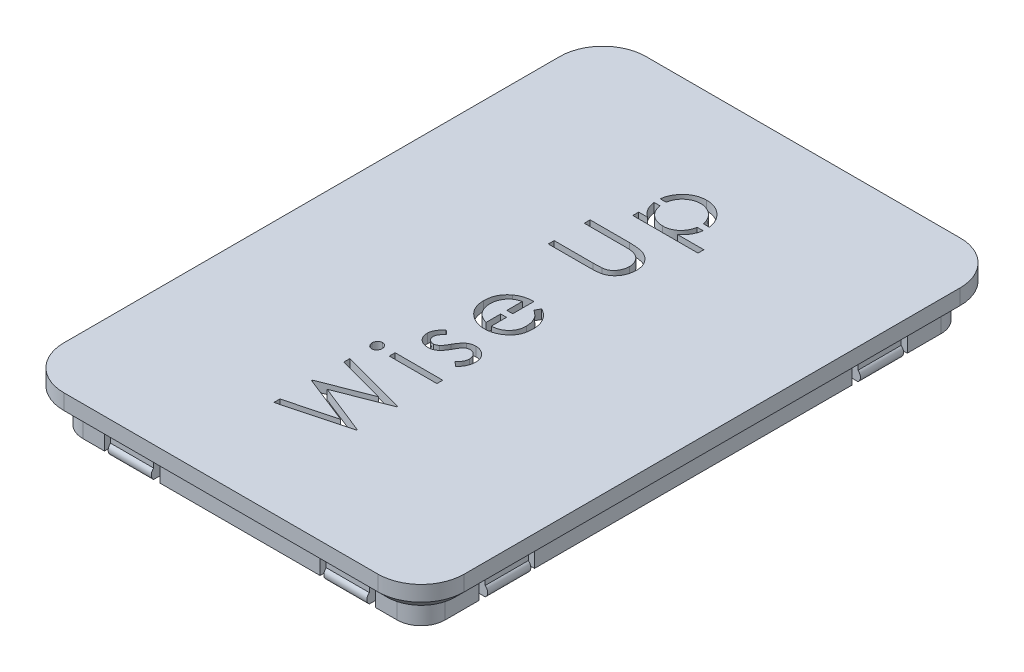
from build123d import *

# Parameters (mm, degrees)
BOSS_EXTRUDE1_DEPTH     = 4
CHAMFER1_SIZE           = 1.5
BOSS_EXTRUDE2_DEPTH     = 4
CUT_EXTRUDE1_START      = -2.5
CUT_EXTRUDE1_DEPTH      = 2.5
SKETCH4_W               = 1
SKETCH4_H               = 1
CUT_EXTRUDE2_DEPTH      = 4
SKETCH5_W               = 1
SKETCH5_H               = 1
CUT_EXTRUDE3_DEPTH      = 4
BOSS_EXTRUDE3_DEPTH     = 7
BOSS_EXTRUDE4_DEPTH     = 7
MIRROR2_COPY_1_SKETCH_W = 1
MIRROR2_COPY_1_SKETCH_H = 1
MIRROR2_COPY_1_DEPTH    = 4
MIRROR2_COPY_2_SKETCH_W = 1
MIRROR2_COPY_2_SKETCH_H = 1
MIRROR2_COPY_2_DEPTH    = 4
MIRROR2_COPY_3_DEPTH    = 7
MIRROR2_COPY_4_DEPTH    = 7
SKETCH9_W               = 7.733974359
SKETCH9_H               = 0.949786325
CUT_EXTRUDE4_DEPTH      = 1.5
SKETCH11_W              = 10
SKETCH11_H              = 1
SKETCH11_W_2            = 5
BOSS_EXTRUDE6_DEPTH     = 1.5


with BuildPart() as part:
    # Sketch1 → Boss-Extrude1 (new body)
    with BuildSketch(Plane(origin=(0, 0, 0), x_dir=(1, 0, 0), z_dir=(0, 1, 0))):
        with BuildLine():
            Line((-30.5, 40), (-30.5, -40.5))
            ThreePointArc((-30.5, -40.5), (-28.449747468, -45.449747468), (-23.5, -47.5))
            Line((-23.5, -47.5), (27.5, -47.5))
            ThreePointArc((27.5, -47.5), (32.449747468, -45.449747468), (34.5, -40.5))
            Line((34.5, -40.5), (34.5, 40))
            ThreePointArc((34.5, 40), (32.449747468, 44.949747468), (27.5, 47))
            Line((27.5, 47), (-23.5, 47))
            ThreePointArc((-23.5, 47), (-28.449747468, 44.949747468), (-30.5, 40))
        make_face()
    extrude(amount=BOSS_EXTRUDE1_DEPTH)

    # Chamfer1
    chamfer1_edges = [part.edges().sort_by_distance(p)[0] for p in [
        (2, 0, 47.5),
        (-28.449747468, 0, 45.449747468),
        (-30.5, 0, 0.25),
        (-28.449747468, 0, -44.949747468),
        (2, 0, -47),
        (32.449747468, 0, -44.949747468),
        (34.5, 0, 0.25),
        (32.449747468, 0, 45.449747468),
    ]]
    chamfer(chamfer1_edges, length=CHAMFER1_SIZE)

    # Sketch2 → Boss-Extrude2 (add)
    with BuildSketch(Plane.XZ):
        with BuildLine():
            Line((-27.4, 40.5), (-27.4, -40))
            ThreePointArc((-27.4, -40), (-26.257716447, -42.757716447), (-23.5, -43.9))
            Line((-23.5, -43.9), (27.5, -43.9))
            ThreePointArc((27.5, -43.9), (30.257716447, -42.757716447), (31.4, -40))
            Line((31.4, -40), (31.4, 40.5))
            ThreePointArc((31.4, 40.5), (30.257716447, 43.257716447), (27.5, 44.4))
            Line((27.5, 44.4), (-23.5, 44.4))
            ThreePointArc((-23.5, 44.4), (-26.257716447, 43.257716447), (-27.4, 40.5))
        make_face()
        with BuildLine():
            Line((27.5, 43.4), (-23.5, 43.4))
            ThreePointArc((-23.5, 43.4), (-25.550609665, 42.550609665), (-26.4, 40.5))
            Line((-26.4, 40.5), (-26.4, -40))
            ThreePointArc((-26.4, -40), (-25.550609665, -42.050609665), (-23.5, -42.9))
            Line((-23.5, -42.9), (27.5, -42.9))
            ThreePointArc((27.5, -42.9), (29.550609665, -42.050609665), (30.4, -40))
            Line((30.4, -40), (30.4, 40.5))
            ThreePointArc((30.4, 40.5), (29.550609665, 42.550609665), (27.5, 43.4))
        make_face(mode=Mode.SUBTRACT)
    extrude(amount=BOSS_EXTRUDE2_DEPTH)

    # Sketch3 → Cut-Extrude1 (cut)
    with BuildSketch(Plane.XZ.offset(CUT_EXTRUDE1_START)):
        with BuildLine():
            Line((30.4, -40), (30.4, 40.5))
            ThreePointArc((30.4, 40.5), (29.550609665, 42.550609665), (27.5, 43.4))
            Line((27.5, 43.4), (-23.5, 43.4))
            ThreePointArc((-23.5, 43.4), (-25.550609665, 42.550609665), (-26.4, 40.5))
            Line((-26.4, 40.5), (-26.4, -40))
            ThreePointArc((-26.4, -40), (-25.550609665, -42.050609665), (-23.5, -42.9))
            Line((-23.5, -42.9), (27.5, -42.9))
            ThreePointArc((27.5, -42.9), (29.550609665, -42.050609665), (30.4, -40))
        make_face()
    extrude(amount=CUT_EXTRUDE1_DEPTH, mode=Mode.SUBTRACT)

    # Sketch4 → Cut-Extrude2 (cut)
    with BuildSketch(Plane.XZ):
        with Locations((-19.5, 43.9)):
            Rectangle(SKETCH4_W, SKETCH4_H)
        with Locations((-11.5, 43.9)):
            Rectangle(SKETCH4_W, SKETCH4_H)
    cut_extrude2 = extrude(amount=CUT_EXTRUDE2_DEPTH, mode=Mode.SUBTRACT)

    # Sketch5 → Cut-Extrude3 (cut)
    with BuildSketch(Plane.XZ):
        with Locations((-26.9, 34.5)):
            Rectangle(SKETCH5_W, SKETCH5_H)
        with Locations((-26.9, 26.5)):
            Rectangle(SKETCH5_W, SKETCH5_H)
    cut_extrude3 = extrude(amount=CUT_EXTRUDE3_DEPTH, mode=Mode.SUBTRACT)

    # Sketch6 → Boss-Extrude3 (add)
    with BuildSketch(Plane(origin=(0, 0, 27), x_dir=(-1, 0, 0), z_dir=(0, 0, -1))):
        with BuildLine():
            Line((27.4, -4), (27.4, -2.4))
            ThreePointArc((27.4, -2.4), (27.8, -3.2), (27.4, -4))
        make_face()
    boss_extrude3 = extrude(amount=-BOSS_EXTRUDE3_DEPTH)

    # Sketch7 → Boss-Extrude4 (add)
    with BuildSketch(Plane.ZY.offset(19)):
        with BuildLine():
            Line((44.4, -2.4), (44.4, -4))
            ThreePointArc((44.4, -4), (44.8, -3.2), (44.4, -2.4))
        make_face()
    boss_extrude4 = extrude(amount=-BOSS_EXTRUDE4_DEPTH)

    # Mirror1: Cut-Extrude2, Cut-Extrude3, Boss-Extrude3, Boss-Extrude4 across plane
    add(cut_extrude2.mirror(Plane(origin=(2, 0, 0), x_dir=(0, 0, 1), z_dir=(1, 0, 0))), mode=Mode.SUBTRACT)
    add(cut_extrude3.mirror(Plane(origin=(2, 0, 0), x_dir=(0, 0, 1), z_dir=(1, 0, 0))), mode=Mode.SUBTRACT)
    add(boss_extrude3.mirror(Plane(origin=(2, 0, 0), x_dir=(0, 0, 1), z_dir=(1, 0, 0))))
    add(boss_extrude4.mirror(Plane(origin=(2, 0, 0), x_dir=(0, 0, 1), z_dir=(1, 0, 0))))

    # Mirror2: Cut-Extrude2, Cut-Extrude3, Boss-Extrude3, Boss-Extrude4 across plane
    add(cut_extrude2.mirror(Plane(origin=(0, 0, 0.25), x_dir=(1, 0, 0), z_dir=(0, 0, -1))), mode=Mode.SUBTRACT)
    add(cut_extrude3.mirror(Plane(origin=(0, 0, 0.25), x_dir=(1, 0, 0), z_dir=(0, 0, -1))), mode=Mode.SUBTRACT)
    add(boss_extrude3.mirror(Plane(origin=(0, 0, 0.25), x_dir=(1, 0, 0), z_dir=(0, 0, -1))))
    add(boss_extrude4.mirror(Plane(origin=(0, 0, 0.25), x_dir=(1, 0, 0), z_dir=(0, 0, -1))))

    # Mirror2 copy 1 sketch → Mirror2 copy 1 (cut)
    with BuildSketch(Plane(origin=(4, 0, 0.5), x_dir=(-1, 0, 0), z_dir=(0, -1, 0))):
        with Locations((-19.5, 43.9)):
            Rectangle(MIRROR2_COPY_1_SKETCH_W, MIRROR2_COPY_1_SKETCH_H)
        with Locations((-11.5, 43.9)):
            Rectangle(MIRROR2_COPY_1_SKETCH_W, MIRROR2_COPY_1_SKETCH_H)
    extrude(amount=MIRROR2_COPY_1_DEPTH, mode=Mode.SUBTRACT)

    # Mirror2 copy 2 sketch → Mirror2 copy 2 (cut)
    with BuildSketch(Plane(origin=(4, 0, 0.5), x_dir=(-1, 0, 0), z_dir=(0, -1, 0))):
        with Locations((-26.9, 34.5)):
            Rectangle(MIRROR2_COPY_2_SKETCH_W, MIRROR2_COPY_2_SKETCH_H)
        with Locations((-26.9, 26.5)):
            Rectangle(MIRROR2_COPY_2_SKETCH_W, MIRROR2_COPY_2_SKETCH_H)
    extrude(amount=MIRROR2_COPY_2_DEPTH, mode=Mode.SUBTRACT)

    # Mirror2 copy 3 sketch → Mirror2 copy 3 (add)
    with BuildSketch(Plane(origin=(4, 0, -26.5), x_dir=(1, 0, 0), z_dir=(0, 0, 1))):
        with BuildLine():
            Line((27.4, -4), (27.4, -2.4))
            ThreePointArc((27.4, -2.4), (27.8, -3.2), (27.4, -4))
        make_face()
    extrude(amount=-MIRROR2_COPY_3_DEPTH)

    # Mirror2 copy 4 sketch → Mirror2 copy 4 (add)
    with BuildSketch(Plane(origin=(23, 0, 0.5), x_dir=(0, 0, -1), z_dir=(1, 0, 0))):
        with BuildLine():
            Line((44.4, -2.4), (44.4, -4))
            ThreePointArc((44.4, -4), (44.8, -3.2), (44.4, -2.4))
        make_face()
    extrude(amount=-MIRROR2_COPY_4_DEPTH)

    # Sketch9 → Cut-Extrude4 (cut)
    # profile 1 of 7: a face of its own
    with BuildSketch(Plane(origin=(0, 4, 0), x_dir=(1, 0, 0), z_dir=(0, 1, 0))):
        Polygon((-5.083333333, -31.821581197), (-5.083333333, -30.83999399), (2.67820179, -28.768696581), (-5.083333333, -25.688251202), (-5.083333333, -25.550447382), (2.625200321, -22.52724359), (-5.083333333, -20.445345887), (-5.083333333, -19.474358974), (5.5, -22.327958066), (5.5, -22.463641827), (-2.594384348, -25.647970085), (5.5, -28.870459402), (5.5, -29.006143162), align=None)
    # profile 2 of 7: a face of its own
    with BuildSketch(Plane(origin=(0, 4, 0), x_dir=(1, 0, 0), z_dir=(0, 1, 0))):
        with BuildLine():
            add(Edge.make_bspline(
                [(-5.490384615, -15.467559206), (-5.487650631, -15.40862118), (-5.482296964, -15.293209204), (-5.436451545, -15.126315276), (-5.358740591, -14.974347644), (-5.254480604, -14.839553071), (-5.131866811, -14.723886652), (-4.988958645, -14.642906884), (-4.834567046, -14.590859877), (-4.7268738, -14.584574722), (-4.672041934, -14.581374644)],
                knots=[0, 0, 0, 0, 1.055194115, 2.066272739, 3.074728998, 4.095836921, 5.109056067, 6.073838105, 7.019297344, 8, 8, 8, 8], degree=3))
            add(Edge.make_bspline(
                [(-4.672041934, -14.581374644), (-4.618633435, -14.584646889), (-4.513051153, -14.591115731), (-4.361336131, -14.642866683), (-4.220413654, -14.724576783), (-4.098037935, -14.839478901), (-3.993835585, -14.974367298), (-3.91610935, -15.126310055), (-3.870267982, -15.293210578), (-3.864913757, -15.408621644), (-3.862179487, -15.467559206)],
                knots=[0, 0, 0, 0, 0.96129708, 1.900370562, 2.859976407, 3.87933698, 4.906634145, 5.921202961, 6.938410037, 8, 8, 8, 8], degree=3))
            add(Edge.make_bspline(
                [(-3.862179487, -15.467559206), (-3.864809355, -15.5258228), (-3.86992805, -15.639225273), (-3.917008818, -15.803620249), (-3.993862182, -15.95429211), (-4.097355647, -16.089349572), (-4.221165217, -16.201926585), (-4.361250129, -16.283866759), (-4.513073049, -16.335498191), (-4.61864079, -16.34198314), (-4.672041934, -16.345263533)],
                knots=[0, 0, 0, 0, 1.054934014, 2.053291228, 3.073705704, 4.106921865, 5.123545215, 6.088680038, 7.033164197, 8, 8, 8, 8], degree=3))
            add(Edge.make_bspline(
                [(-4.672041934, -16.345263533), (-4.726866169, -16.342055009), (-4.834544428, -16.335753266), (-4.989046075, -16.283828057), (-5.131109187, -16.202609115), (-5.255162483, -16.08927503), (-5.358714155, -15.954311948), (-5.435552123, -15.803615123), (-5.482636887, -15.639226627), (-5.487755031, -15.525823259), (-5.490384615, -15.467559206)],
                knots=[0, 0, 0, 0, 0.98631895, 1.937192651, 2.907499808, 3.917963147, 4.944918757, 5.95915025, 6.951458133, 8, 8, 8, 8], degree=3))
        make_face()
    # profile 3 of 7: a face of its own
    with BuildSketch(Plane(origin=(0, 4, 0), x_dir=(1, 0, 0), z_dir=(0, 1, 0))):
        with Locations((1.63301282, -15.463319089)):
            Rectangle(SKETCH9_W, SKETCH9_H)
    # profile 4 of 7: a face of its own
    with BuildSketch(Plane(origin=(0, 4, 0), x_dir=(1, 0, 0), z_dir=(0, 1, 0))):
        with BuildLine():
            Line((-1.269347623, -7.653133903), (-0.605769231, -8.297631766))
            add(Edge.make_bspline(
                [(-0.605769231, -8.297631766), (-0.670216126, -8.353241146), (-0.794462152, -8.460449484), (-0.960581377, -8.630482771), (-1.100090692, -8.799887477), (-1.217874904, -8.966344604), (-1.306923514, -9.134039846), (-1.371919882, -9.301005289), (-1.412142009, -9.467413808), (-1.417326145, -9.578647772), (-1.419871795, -9.633268786)],
                knots=[0, 0, 0, 0, 1.26578478, 2.440284043, 3.530471711, 4.527705817, 5.468200915, 6.346673037, 7.188140097, 8, 8, 8, 8], degree=3))
            add(Edge.make_bspline(
                [(-1.419871795, -9.633268786), (-1.416613136, -9.700206811), (-1.410200557, -9.83193137), (-1.34647994, -10.020800514), (-1.248234845, -10.195210383), (-1.111557745, -10.348235446), (-0.951502527, -10.476681647), (-0.771898701, -10.569366033), (-0.579625417, -10.627299754), (-0.446462023, -10.63451642), (-0.378922943, -10.638176638)],
                knots=[0, 0, 0, 0, 0.999370852, 1.966620401, 2.952450547, 3.979894107, 5.019529251, 6.00881856, 6.990093614, 8, 8, 8, 8], degree=3))
            add(Edge.make_bspline(
                [(-0.378922943, -10.638176638), (-0.317805572, -10.634817753), (-0.195743118, -10.628109453), (-0.015681206, -10.57595878), (0.159872219, -10.492906609), (0.267407674, -10.415284831), (0.322816506, -10.375289352)],
                knots=[0, 0, 0, 0, 0.960159726, 1.917612774, 2.927026955, 4, 4, 4, 4], degree=3))
            add(Edge.make_bspline(
                [(0.322816506, -10.375289352), (0.352272176, -10.351085396), (0.415344465, -10.2992584), (0.505104918, -10.205253566), (0.598961788, -10.093895291), (0.69627832, -9.964126329), (0.797156461, -9.815685847), (0.903309824, -9.65074923), (1.011631041, -9.467277985), (1.082848853, -9.338067144), (1.1199586, -9.270738738)],
                knots=[0, 0, 0, 0, 0.667332049, 1.428932371, 2.272176193, 3.217953793, 4.268659351, 5.415594948, 6.6533338, 8, 8, 8, 8], degree=3))
            add(Edge.make_bspline(
                [(1.1199586, -9.270738738), (1.166036898, -9.188435336), (1.255044996, -9.029452265), (1.393523305, -8.803793766), (1.530235658, -8.597786749), (1.668307822, -8.414275634), (1.802060267, -8.248957443), (1.935190503, -8.104488676), (2.068050408, -7.980421885), (2.161000307, -7.911028785), (2.205428686, -7.877860132)],
                knots=[0, 0, 0, 0, 1.271974443, 2.457035787, 3.569878245, 4.604907449, 5.553098313, 6.436573686, 7.252710343, 8, 8, 8, 8], degree=3))
            add(Edge.make_bspline(
                [(2.205428686, -7.877860132), (2.295103805, -7.822712843), (2.474135191, -7.712614349), (2.768595229, -7.598924781), (3.080042566, -7.531124187), (3.292671878, -7.522069346), (3.401141827, -7.517450142)],
                knots=[0, 0, 0, 0, 0.995432674, 1.98732596, 2.973261739, 4, 4, 4, 4], degree=3))
            add(Edge.make_bspline(
                [(3.401141827, -7.517450142), (3.477550781, -7.519626052), (3.628122971, -7.52391392), (3.849875413, -7.553720304), (4.061942023, -7.604998233), (4.266665041, -7.674795277), (4.459969333, -7.769218931), (4.646819949, -7.878965868), (4.821572298, -8.013049011), (4.987277812, -8.163692128), (5.138840058, -8.329538077), (5.271449846, -8.50715605), (5.384937067, -8.69405715), (5.475894658, -8.892950405), (5.548865869, -9.101368177), (5.599197039, -9.320357781), (5.629367238, -9.549036111), (5.633551631, -9.704551246), (5.635683761, -9.783792958)],
                knots=[0, 0, 0, 0, 1.03294705, 2.035535002, 3.018074688, 3.978914202, 4.953244146, 5.921606783, 6.903774788, 7.924990491, 8.946206195, 9.936011882, 10.917482605, 11.896392379, 12.887442265, 13.897874922, 14.928876017, 16, 16, 16, 16], degree=3))
            add(Edge.make_bspline(
                [(5.635683761, -9.783792958), (5.63269562, -9.890741867), (5.626760858, -10.103153639), (5.570601418, -10.417218041), (5.484224591, -10.724754296), (5.361074969, -11.02134364), (5.209673798, -11.302455191), (5.030541626, -11.561177965), (4.824625345, -11.794820126), (4.667124937, -11.928282872), (4.588374733, -11.995014245)],
                knots=[0, 0, 0, 0, 1.014105853, 2.01412079, 3.018242674, 4.040740662, 5.055023907, 6.042888753, 7.021444376, 8, 8, 8, 8], degree=3))
            Line((4.588374733, -11.995014245), (3.871794872, -11.365356793))
            add(Edge.make_bspline(
                [(3.871794872, -11.365356793), (3.936367612, -11.305568782), (4.061551633, -11.189660684), (4.228237139, -11.00429748), (4.367940983, -10.815674053), (4.484791309, -10.62567393), (4.574826456, -10.431484597), (4.6380803, -10.234194287), (4.678732976, -10.03420429), (4.683505401, -9.899880213), (4.685897436, -9.832554309)],
                knots=[0, 0, 0, 0, 1.179806542, 2.287233372, 3.337373186, 4.324005949, 5.273901747, 6.200048787, 7.097828587, 8, 8, 8, 8], degree=3))
            add(Edge.make_bspline(
                [(4.685897436, -9.832554309), (4.681751953, -9.740879354), (4.673652376, -9.561761869), (4.600127315, -9.305200969), (4.484810149, -9.068355599), (4.321342424, -8.862529926), (4.131159785, -8.68834831), (3.917713723, -8.559680995), (3.684819774, -8.481717868), (3.523273867, -8.472106358), (3.441422943, -8.467236467)],
                knots=[0, 0, 0, 0, 1.072236613, 2.094970478, 3.102399718, 4.141104368, 5.155589565, 6.110053346, 7.042415349, 8, 8, 8, 8], degree=3))
            add(Edge.make_bspline(
                [(3.441422943, -8.467236467), (3.373932851, -8.4704198), (3.241368334, -8.476672525), (3.049041625, -8.528839986), (2.865559718, -8.607742884), (2.758105269, -8.687552548), (2.703642495, -8.728003695)],
                knots=[0, 0, 0, 0, 1.014054094, 1.991812201, 2.982159616, 4, 4, 4, 4], degree=3))
            add(Edge.make_bspline(
                [(2.703642495, -8.728003695), (2.676313789, -8.752256638), (2.616781996, -8.805088307), (2.530976843, -8.902120165), (2.437900015, -9.017377122), (2.343182201, -9.155978392), (2.238253554, -9.31093111), (2.134198165, -9.490511345), (2.020711441, -9.687758923), (1.945707442, -9.827400811), (1.906500401, -9.900396189)],
                knots=[0, 0, 0, 0, 0.615029206, 1.339755737, 2.178261527, 3.109653826, 4.166232585, 5.329982127, 6.604294388, 8, 8, 8, 8], degree=3))
            add(Edge.make_bspline(
                [(1.906500401, -9.900396189), (1.862536836, -9.979156268), (1.777277453, -10.131897195), (1.644483592, -10.348242574), (1.509418261, -10.543421479), (1.379658009, -10.722130359), (1.248361345, -10.879855305), (1.115382513, -11.015974958), (0.98608446, -11.135848492), (0.894471206, -11.202213284), (0.850711138, -11.23391315)],
                knots=[0, 0, 0, 0, 1.262093308, 2.447601706, 3.550203992, 4.582594899, 5.537233252, 6.418365656, 7.244515135, 8, 8, 8, 8], degree=3))
            add(Edge.make_bspline(
                [(0.850711138, -11.23391315), (0.76255282, -11.288657176), (0.586767771, -11.397815127), (0.292997124, -11.505686024), (-0.017112446, -11.577787837), (-0.231501631, -11.58452796), (-0.340761886, -11.587962963)],
                knots=[0, 0, 0, 0, 0.984940175, 1.963941237, 2.962352981, 4, 4, 4, 4], degree=3))
            add(Edge.make_bspline(
                [(-0.340761886, -11.587962963), (-0.412201531, -11.586349801), (-0.552019039, -11.583192614), (-0.757439821, -11.557931619), (-0.952669572, -11.512104888), (-1.140972095, -11.453896473), (-1.319066287, -11.374907636), (-1.487775599, -11.278556883), (-1.647283761, -11.166203025), (-1.795432268, -11.036620101), (-1.930084898, -10.894215136), (-2.04717999, -10.740209467), (-2.147942504, -10.578974817), (-2.22877169, -10.407243385), (-2.292975466, -10.227033653), (-2.336471977, -10.036988983), (-2.365727667, -9.838410683), (-2.368329101, -9.702634199), (-2.36965812, -9.633268786)],
                knots=[0, 0, 0, 0, 1.087304385, 2.128008728, 3.143103065, 4.136477636, 5.123835063, 6.101831209, 7.089715868, 8.088492253, 9.092987035, 10.067605355, 11.028834439, 11.98153898, 12.951158004, 13.934816901, 14.944940436, 16, 16, 16, 16], degree=3))
            add(Edge.make_bspline(
                [(-2.36965812, -9.633268786), (-2.366318804, -9.551045165), (-2.35957753, -9.385055494), (-2.306038894, -9.136030792), (-2.217945936, -8.887372829), (-2.096279231, -8.638442699), (-1.938838916, -8.391063967), (-1.748552701, -8.143060615), (-1.526672469, -7.89145538), (-1.357039097, -7.734349386), (-1.269347623, -7.653133903)],
                knots=[0, 0, 0, 0, 0.845714091, 1.707292901, 2.609013841, 3.555613372, 4.552488639, 5.621697636, 6.770543573, 8, 8, 8, 8], degree=3))
        make_face()
    # profile 5 of 7: a face of its own
    with BuildSketch(Plane(origin=(0, 4, 0), x_dir=(1, 0, 0), z_dir=(0, 1, 0))):
        with BuildLine():
            Line((3.057692308, 2.23046875), (3.500784589, 3.074252137))
            add(Edge.make_bspline(
                [(3.500784589, 3.074252137), (3.620025437, 3.006977633), (3.852020906, 2.87608809), (4.170772669, 2.651912158), (4.455819739, 2.414759412), (4.702597691, 2.157414238), (4.920533266, 1.887631535), (5.108514887, 1.60028729), (5.26993442, 1.297726918), (5.402202665, 0.976617868), (5.50618627, 0.637344796), (5.582978872, 0.277939001), (5.627511284, -0.103296499), (5.63291618, -0.364366053), (5.635683761, -0.498046875)],
                knots=[0, 0, 0, 0, 1.120611642, 2.180266485, 3.186550691, 4.152466804, 5.095166165, 6.022949561, 6.960161436, 7.899497276, 8.862391909, 9.862399089, 10.905440174, 12, 12, 12, 12], degree=3))
            add(Edge.make_bspline(
                [(5.635683761, -0.498046875), (5.632214921, -0.646642854), (5.625448219, -0.936510562), (5.567111483, -1.358452182), (5.47194506, -1.755718506), (5.339001655, -2.128287272), (5.165352301, -2.475245829), (4.953808393, -2.79728472), (4.705455192, -3.096093901), (4.41814701, -3.362270857), (4.110667359, -3.601857675), (3.790323137, -3.813414215), (3.458223729, -3.989459585), (3.116345055, -4.134850333), (2.765463999, -4.249536082), (2.403571025, -4.331033543), (2.032101142, -4.377579492), (1.78083585, -4.384744149), (1.654213408, -4.388354701)],
                knots=[0, 0, 0, 0, 1.14524686, 2.234044844, 3.276713788, 4.290115724, 5.276966211, 6.260758605, 7.254862358, 8.264742877, 9.274005885, 10.257798278, 11.220590477, 12.167824544, 13.118936889, 14.062732937, 15.023735098, 16, 16, 16, 16], degree=3))
            add(Edge.make_bspline(
                [(1.654213408, -4.388354701), (1.535393326, -4.385152059), (1.299907613, -4.378804846), (0.951366562, -4.338797465), (0.61261386, -4.267894294), (0.28336803, -4.170599219), (-0.035819661, -4.044956165), (-0.345143473, -3.891249216), (-0.644274253, -3.709238931), (-0.832969443, -3.568714418), (-0.928018162, -3.497930021)],
                knots=[0, 0, 0, 0, 1.024358464, 2.0301432, 3.019427413, 4.004406732, 4.986367066, 5.972626655, 6.978780325, 8, 8, 8, 8], degree=3))
            add(Edge.make_bspline(
                [(-0.928018162, -3.497930021), (-1.042716274, -3.40221732), (-1.268110724, -3.214131298), (-1.561570905, -2.892710141), (-1.812601004, -2.549357235), (-2.017391854, -2.18061886), (-2.174908397, -1.787116137), (-2.286947831, -1.370878722), (-2.356663884, -0.930756145), (-2.365260855, -0.629047304), (-2.36965812, -0.474726229)],
                knots=[0, 0, 0, 0, 1.030811313, 2.025658015, 2.997072178, 3.962767568, 4.930766827, 5.917075773, 6.934604948, 8, 8, 8, 8], degree=3))
            add(Edge.make_bspline(
                [(-2.36965812, -0.474726229), (-2.36558424, -0.316125541), (-2.357592217, -0.004987146), (-2.282837139, 0.448552566), (-2.165728819, 0.878544044), (-1.995107556, 1.281438789), (-1.783610847, 1.663444815), (-1.516288909, 2.015770295), (-1.206871713, 2.348086795), (-0.968668679, 2.541313923), (-0.847455929, 2.639640091)],
                knots=[0, 0, 0, 0, 1.056389096, 2.072394598, 3.055233004, 4.020130009, 4.981825462, 5.957811105, 6.960805292, 8, 8, 8, 8], degree=3))
            add(Edge.make_bspline(
                [(-0.847455929, 2.639640091), (-0.756126052, 2.706547738), (-0.574074217, 2.839917674), (-0.277223338, 3.006974381), (0.033353936, 3.151988409), (0.362677929, 3.267899981), (0.70684666, 3.361757521), (1.068320545, 3.429662663), (1.446991944, 3.469485081), (1.705003195, 3.477312809), (1.836538462, 3.481303419)],
                knots=[0, 0, 0, 0, 0.94817472, 1.890038105, 2.849395472, 3.817997239, 4.812318967, 5.836947057, 6.897266129, 8, 8, 8, 8], degree=3))
            Line((1.836538462, 3.481303419), (1.836538462, -3.438568376))
            add(Edge.make_bspline(
                [(1.836538462, -3.438568376), (1.938442246, -3.433912899), (2.138831929, -3.424758093), (2.432053106, -3.382076588), (2.711372498, -3.314800534), (2.97469503, -3.220248845), (3.225459939, -3.105746717), (3.461807051, -2.965485145), (3.68265984, -2.798148875), (3.889993803, -2.611502117), (4.074629914, -2.403744948), (4.239886476, -2.185175689), (4.378393876, -1.952664195), (4.49081878, -1.708043799), (4.578830736, -1.451710068), (4.638907241, -1.18358224), (4.679145398, -0.904187936), (4.683619624, -0.713731073), (4.685897436, -0.616770166)],
                knots=[0, 0, 0, 0, 1.094153842, 2.151609401, 3.174256925, 4.172055639, 5.149267565, 6.128595816, 7.11444997, 8.118368179, 9.117203808, 10.09244225, 11.054858984, 12.015122123, 12.976791628, 13.957293641, 14.960065497, 16, 16, 16, 16], degree=3))
            add(Edge.make_bspline(
                [(4.685897436, -0.616770166), (4.684073594, -0.521966131), (4.680454743, -0.333856739), (4.644761576, -0.053789363), (4.588191003, 0.222226451), (4.506712173, 0.491449941), (4.411301562, 0.749957511), (4.299003889, 0.990672157), (4.170971831, 1.210411509), (4.025479433, 1.416587951), (3.84692205, 1.615486301), (3.626240731, 1.815918032), (3.360932504, 2.026090104), (3.162576112, 2.15977888), (3.057692308, 2.23046875)],
                knots=[0, 0, 0, 0, 0.991168677, 1.966668791, 2.94808785, 3.9350306, 4.905702032, 5.828266021, 6.709360349, 7.562606342, 8.463112863, 9.498839253, 10.677475166, 12, 12, 12, 12], degree=3))
        make_face()
        with BuildLine():
            add(Edge.make_bspline(
                [(0.886752137, 2.531517094), (0.760708587, 2.496894269), (0.518745919, 2.430429693), (0.183803194, 2.288881829), (-0.115589557, 2.133312728), (-0.374457094, 1.946038141), (-0.604734185, 1.73592324), (-0.80275311, 1.489873611), (-0.985263358, 1.218560707), (-1.137250945, 0.916580525), (-1.262148158, 0.595841658), (-1.353986218, 0.262936556), (-1.407971381, -0.079346397), (-1.415886343, -0.30988226), (-1.419871795, -0.425964877)],
                knots=[0, 0, 0, 0, 1.155085888, 2.217389643, 3.210301801, 4.133263417, 5.03575695, 5.95948047, 6.920061569, 7.923798377, 8.943125483, 9.960783337, 10.973185325, 12, 12, 12, 12], degree=3))
            add(Edge.make_bspline(
                [(-1.419871795, -0.425964877), (-1.418043785, -0.520766852), (-1.414430193, -0.708170424), (-1.379435085, -0.984142803), (-1.323201832, -1.24986107), (-1.240519492, -1.504532072), (-1.139911425, -1.749845131), (-1.016243754, -1.985622992), (-0.866727375, -2.208834687), (-0.752512595, -2.348341681), (-0.694811699, -2.418820112)],
                knots=[0, 0, 0, 0, 1.048823158, 2.073302879, 3.073550078, 4.050623576, 5.03253758, 6.005186856, 6.992227572, 8, 8, 8, 8], degree=3))
            add(Edge.make_bspline(
                [(-0.694811699, -2.418820112), (-0.649174161, -2.469305328), (-0.556814906, -2.571475101), (-0.397599335, -2.707847966), (-0.225815055, -2.839393931), (-0.033963526, -2.956291688), (0.172391768, -3.067385653), (0.39475655, -3.168621059), (0.634069426, -3.260668978), (0.800913294, -3.312341053), (0.886752137, -3.338925614)],
                knots=[0, 0, 0, 0, 0.879905587, 1.780714457, 2.708106151, 3.677566983, 4.684151534, 5.740052498, 6.837288539, 8, 8, 8, 8], degree=3))
            Line((0.886752137, -3.338925614), (0.886752137, 2.531517094))
        make_face(mode=Mode.SUBTRACT)
    # profile 6 of 7: a face of its own
    with BuildSketch(Plane(origin=(0, 4, 0), x_dir=(1, 0, 0), z_dir=(0, 1, 0))):
        with BuildLine():
            Line((-5.083333333, 12.724537037), (-5.083333333, 13.674323362))
            Line((-5.083333333, 13.674323362), (1.25776242, 13.674323362))
            add(Edge.make_bspline(
                [(1.25776242, 13.674323362), (1.347511311, 13.674182017), (1.517825299, 13.673913791), (1.76023897, 13.67570544), (1.97575331, 13.680723054), (2.165199052, 13.683886441), (2.327706883, 13.690923854), (2.464157228, 13.696663187), (2.573903983, 13.704042965), (2.637951069, 13.712912154), (2.665481437, 13.716724537)],
                knots=[0, 0, 0, 0, 1.528628734, 2.90083645, 4.128790002, 5.200304208, 6.127813768, 6.898992206, 7.526736466, 8, 8, 8, 8], degree=3))
            add(Edge.make_bspline(
                [(2.665481437, 13.716724537), (2.765565318, 13.732201855), (2.958772754, 13.762080122), (3.233705588, 13.841461101), (3.481944981, 13.947288733), (3.709090335, 14.07857424), (3.913698117, 14.244454047), (4.097338718, 14.450398949), (4.264221347, 14.692716632), (4.409719006, 14.967935394), (4.530567072, 15.261181468), (4.620992442, 15.561941983), (4.676332711, 15.864412271), (4.682723764, 16.06694076), (4.685897436, 16.167512464)],
                knots=[0, 0, 0, 0, 1.042777144, 2.01303441, 2.939567723, 3.817555404, 4.708046775, 5.641195415, 6.651191522, 7.732783915, 8.843021186, 9.914367358, 10.964315445, 12, 12, 12, 12], degree=3))
            add(Edge.make_bspline(
                [(4.685897436, 16.167512464), (4.682668317, 16.253861127), (4.67622873, 16.426059726), (4.635860611, 16.681780404), (4.564541755, 16.931624743), (4.467392454, 17.173629996), (4.347924857, 17.403863169), (4.204804618, 17.616421374), (4.038097257, 17.806908038), (3.85333949, 17.980737735), (3.645138849, 18.131218151), (3.418518203, 18.264266368), (3.167434811, 18.369931112), (2.991085699, 18.423428852), (2.900807959, 18.45081575)],
                knots=[0, 0, 0, 0, 0.994718802, 1.98369237, 2.973235266, 3.981451368, 4.982709966, 5.955777334, 6.925228988, 7.892833478, 8.871333226, 9.877970804, 10.913677552, 12, 12, 12, 12], degree=3))
            add(Edge.make_bspline(
                [(2.900807959, 18.45081575), (2.863468223, 18.459887557), (2.780260241, 18.4801032), (2.63958872, 18.498993074), (2.473613739, 18.518667568), (2.281142781, 18.532318767), (2.062820792, 18.54562722), (1.817510442, 18.55358913), (1.546102489, 18.557269206), (1.356699643, 18.558365882), (1.25776242, 18.558938746)],
                knots=[0, 0, 0, 0, 0.558680831, 1.244966039, 2.062412453, 2.990489873, 4.051219941, 5.244515665, 6.560634259, 8, 8, 8, 8], degree=3))
            Line((1.25776242, 18.558938746), (-5.083333333, 18.558938746))
            Line((-5.083333333, 18.558938746), (-5.083333333, 19.508725071))
            Line((-5.083333333, 19.508725071), (1.30864383, 19.508725071))
            add(Edge.make_bspline(
                [(1.30864383, 19.508725071), (1.423846048, 19.50795655), (1.648670182, 19.506456735), (1.978118656, 19.49345413), (2.290637265, 19.4727145), (2.586274422, 19.443438002), (2.863950233, 19.4045581), (3.125493685, 19.361721314), (3.369462795, 19.306215413), (3.598672337, 19.241862332), (3.817960945, 19.1693452), (4.025669065, 19.073772228), (4.227897104, 18.966560948), (4.422380646, 18.840432525), (4.607884054, 18.695327264), (4.7892093, 18.536804317), (4.960952404, 18.359276207), (5.125231541, 18.167986558), (5.278011181, 17.964221511), (5.410964102, 17.746665358), (5.51922383, 17.516519205), (5.615306473, 17.279232744), (5.683599568, 17.029116894), (5.735525928, 16.769287202), (5.764782689, 16.498202488), (5.769153969, 16.3138615), (5.771367521, 16.220513933)],
                knots=[0, 0, 0, 0, 1.316707045, 2.569633854, 3.76780728, 4.896239288, 5.964314126, 6.972204208, 7.924543903, 8.822147865, 9.693191779, 10.560896119, 11.431827672, 12.307838457, 13.206132673, 14.12176355, 15.058527151, 16.026630406, 17.00238624, 17.966538933, 18.934743273, 19.906713913, 20.888635248, 21.892958714, 22.933025263, 24, 24, 24, 24], degree=3))
            add(Edge.make_bspline(
                [(5.771367521, 16.220513933), (5.768996185, 16.118704237), (5.764343632, 15.918953976), (5.737642025, 15.624632733), (5.687476042, 15.342429997), (5.623185887, 15.069591544), (5.535965602, 14.808753297), (5.428795135, 14.559992123), (5.306443764, 14.320451725), (5.161866329, 14.095528891), (5.004214367, 13.883378508), (4.831050974, 13.690582318), (4.648971097, 13.512246171), (4.451118515, 13.356230728), (4.241543449, 13.216634966), (4.019260172, 13.096534948), (3.784566665, 12.993373231), (3.621421174, 12.940135652), (3.538945646, 12.913222267)],
                knots=[0, 0, 0, 0, 1.138939089, 2.234594419, 3.301501784, 4.342532435, 5.367382236, 6.373123747, 7.370098489, 8.372230273, 9.360297234, 10.323289009, 11.268038109, 12.20748145, 13.137029304, 14.081414587, 15.030090602, 16, 16, 16, 16], degree=3))
            add(Edge.make_bspline(
                [(3.538945646, 12.913222267), (3.48260429, 12.897567527), (3.360398634, 12.863612046), (3.158146633, 12.827249837), (2.925268192, 12.7966819), (2.661747369, 12.767938902), (2.367379916, 12.750978482), (2.042293432, 12.736109084), (1.686094834, 12.724432284), (1.437977608, 12.724501143), (1.30864383, 12.724537037)],
                knots=[0, 0, 0, 0, 0.625038921, 1.35572334, 2.194682327, 3.136881307, 4.189498639, 5.346923369, 6.617055217, 8, 8, 8, 8], degree=3))
            Line((1.30864383, 12.724537037), (-5.083333333, 12.724537037))
        make_face()
    # profile 7 of 7: a face of its own
    with BuildSketch(Plane(origin=(0, 4, 0), x_dir=(1, 0, 0), z_dir=(0, 1, 0))):
        with BuildLine():
            Line((-2.233974359, 23.587606838), (-2.233974359, 24.537393162))
            Line((-2.233974359, 24.537393162), (-0.802934696, 24.537393162))
            add(Edge.make_bspline(
                [(-0.802934696, 24.537393162), (-0.931770876, 24.638550575), (-1.182933, 24.835753802), (-1.512126484, 25.170499715), (-1.784138562, 25.530153381), (-2.003451397, 25.912446733), (-2.165411944, 26.319806939), (-2.285945861, 26.746410672), (-2.356760393, 27.197117541), (-2.365301995, 27.505227174), (-2.36965812, 27.662359776)],
                knots=[0, 0, 0, 0, 1.07939028, 2.104237756, 3.085658289, 4.045737152, 5.001099604, 5.968961907, 6.964192404, 8, 8, 8, 8], degree=3))
            add(Edge.make_bspline(
                [(-2.36965812, 27.662359776), (-2.365687317, 27.799615338), (-2.357838816, 28.070908167), (-2.304701247, 28.470242216), (-2.213631081, 28.854796352), (-2.08239498, 29.222394991), (-1.920151059, 29.576976165), (-1.715387642, 29.913290609), (-1.478302256, 30.236576837), (-1.205457419, 30.538704361), (-0.910248137, 30.817866592), (-0.592680693, 31.059306235), (-0.263198587, 31.267561755), (0.083306073, 31.435898127), (0.444104696, 31.567761464), (0.820654982, 31.661543941), (1.211560802, 31.717356339), (1.477361886, 31.724844657), (1.611812233, 31.728632479)],
                knots=[0, 0, 0, 0, 1.041296284, 2.058176809, 3.050446431, 4.034000596, 5.01514041, 6.003636468, 7.015969324, 8.052561599, 9.08815499, 10.094063707, 11.074456064, 12.040834395, 13.011057502, 13.983766392, 14.980127149, 16, 16, 16, 16], degree=3))
            add(Edge.make_bspline(
                [(1.611812233, 31.728632479), (1.749100166, 31.724926844), (2.019851782, 31.717618797), (2.417443719, 31.660937469), (2.799917444, 31.570353588), (3.166636789, 31.440153844), (3.517349258, 31.271904582), (3.851801932, 31.067178887), (4.169887654, 30.825617427), (4.46728809, 30.549540208), (4.741243155, 30.250022996), (4.980843984, 29.929869635), (5.182052429, 29.594048598), (5.350124711, 29.244277998), (5.476798696, 28.877563567), (5.56817157, 28.495616275), (5.624518735, 28.09864407), (5.631933547, 27.828614396), (5.635683761, 27.692040598)],
                knots=[0, 0, 0, 0, 1.038740735, 2.04854663, 3.033179607, 4.009277356, 4.987731542, 5.972001279, 6.972200261, 8.005528982, 9.039189865, 10.040446548, 11.026516639, 11.997840187, 12.972163198, 13.956796175, 14.96660207, 16, 16, 16, 16], degree=3))
            add(Edge.make_bspline(
                [(5.635683761, 27.692040598), (5.631463312, 27.538405719), (5.623129852, 27.235046952), (5.549165007, 26.790243363), (5.427686835, 26.364092168), (5.257325113, 25.957845463), (5.03852452, 25.57037174), (4.772182768, 25.203198888), (4.45834605, 24.854509184), (4.220279356, 24.644629461), (4.098641159, 24.537393162)],
                knots=[0, 0, 0, 0, 1.014661154, 2.003492687, 2.970165371, 3.937187664, 4.907406957, 5.904113462, 6.929124205, 8, 8, 8, 8], degree=3))
            Line((4.098641159, 24.537393162), (8.349358974, 24.537393162))
            Line((8.349358974, 24.537393162), (8.349358974, 23.587606838))
            Line((8.349358974, 23.587606838), (-2.233974359, 23.587606838))
        make_face()
        with BuildLine():
            add(Edge.make_bspline(
                [(-1.419871795, 27.653879541), (-1.417935776, 27.546293721), (-1.414124254, 27.334484972), (-1.368845885, 27.024023738), (-1.303115096, 26.724982802), (-1.203595779, 26.440375949), (-1.081437463, 26.167475275), (-0.928789476, 25.908382682), (-0.748413173, 25.663280037), (-0.543763728, 25.432784017), (-0.318264076, 25.224554534), (-0.077605701, 25.040214252), (0.177906626, 24.885373115), (0.445892841, 24.756855101), (0.728453584, 24.659055175), (1.023979599, 24.589641451), (1.332794348, 24.546006813), (1.543118463, 24.540295026), (1.649973291, 24.537393162)],
                knots=[0, 0, 0, 0, 1.05670511, 2.080379991, 3.077984906, 4.06214886, 5.038337365, 6.01289324, 7.01187578, 8.025460281, 9.038092164, 10.024533457, 11.000252242, 11.969694649, 12.940728589, 13.933144304, 14.949937299, 16, 16, 16, 16], degree=3))
            add(Edge.make_bspline(
                [(1.649973291, 24.537393162), (1.790236752, 24.542223831), (2.065024752, 24.55168752), (2.465953045, 24.627890705), (2.845014178, 24.753301036), (3.199741325, 24.930610372), (3.527935057, 25.152094285), (3.818389469, 25.423793521), (4.074909354, 25.735605952), (4.290972154, 26.086658115), (4.465528028, 26.463337412), (4.59444242, 26.854929749), (4.670958856, 27.258687117), (4.680890945, 27.53130223), (4.685897436, 27.668719952)],
                knots=[0, 0, 0, 0, 1.037533453, 2.032615907, 3.008487753, 3.983910949, 4.958815134, 5.928528047, 6.917017829, 7.938835504, 8.970843303, 9.983125212, 10.983349323, 12, 12, 12, 12], degree=3))
            add(Edge.make_bspline(
                [(4.685897436, 27.668719952), (4.681191112, 27.803387474), (4.671849904, 28.070678294), (4.591000736, 28.464253985), (4.46748544, 28.846728691), (4.287418055, 29.210164457), (4.066600032, 29.551194549), (3.80189507, 29.860137962), (3.492991287, 30.127779629), (3.151319316, 30.358078619), (2.785275279, 30.542193325), (2.407226764, 30.682049206), (2.017241993, 30.761726232), (1.754194529, 30.773132048), (1.622412527, 30.778846154)],
                knots=[0, 0, 0, 0, 1.001123591, 1.987050352, 2.978152323, 3.984730168, 4.995502505, 5.994801396, 7.000994558, 8.027767845, 9.053126238, 10.042874082, 11.019515457, 12, 12, 12, 12], degree=3))
            add(Edge.make_bspline(
                [(1.622412527, 30.778846154), (1.489805652, 30.774444329), (1.225625045, 30.765674975), (0.836236839, 30.679398729), (0.455706274, 30.549504633), (0.094318322, 30.361273509), (-0.244815188, 30.134539648), (-0.548150521, 29.866383155), (-0.808718501, 29.558946242), (-1.029711583, 29.220562996), (-1.202231806, 28.853903123), (-1.329109687, 28.469089437), (-1.405169174, 28.066747716), (-1.414927811, 27.792712848), (-1.419871795, 27.653879541)],
                knots=[0, 0, 0, 0, 0.984010603, 1.960354772, 2.950163297, 3.964735994, 4.97843856, 5.975353722, 6.962442164, 7.964544167, 8.969901786, 9.964615439, 10.968820376, 12, 12, 12, 12], degree=3))
        make_face(mode=Mode.SUBTRACT)
    extrude(amount=-CUT_EXTRUDE4_DEPTH, mode=Mode.SUBTRACT)


with BuildPart() as cut_extrude4_piece_1:
    # of the separate pieces the step leaves, piece 1, a body of its own (cut_extrude4_pieces)
    add(part.part.solids().sort_by_distance((-30.5, 1.5, -40))[0])



with BuildPart() as cut_extrude4_piece_2:
    # of the separate pieces the step leaves, piece 2, a body of its own (cut_extrude4_pieces)
    add(part.part.solids().sort_by_distance((1.622412527, 4, -30.778846154))[0])


with BuildPart() as cut_extrude4_piece_3:
    # of the separate pieces the step leaves, piece 3, a body of its own (cut_extrude4_pieces)
    add(part.part.solids().sort_by_distance((0.886752137, 4, 3.338925614))[0])


with BuildPart() as cut_extrude4_piece_1_1:
    add(cut_extrude4_piece_1.part)

    add(cut_extrude4_piece_2.part)  # Boss-Extrude6 merges Cut-Extrude4 piece 2

    add(cut_extrude4_piece_3.part)  # Boss-Extrude6 merges Cut-Extrude4 piece 3
    # Sketch11 → Boss-Extrude6 (add)
    with BuildSketch(Plane(origin=(0, 4, 0), x_dir=(1, 0, 0), z_dir=(0, 1, 0))):
        with Locations((1.622412527, 27.653879541)):
            Rectangle(SKETCH11_W, SKETCH11_H)
        with Locations((1.7, -0.474726229)):
            Rectangle(SKETCH11_W_2, SKETCH11_H)
    extrude(amount=-BOSS_EXTRUDE6_DEPTH)


solid = cut_extrude4_piece_1_1.part
